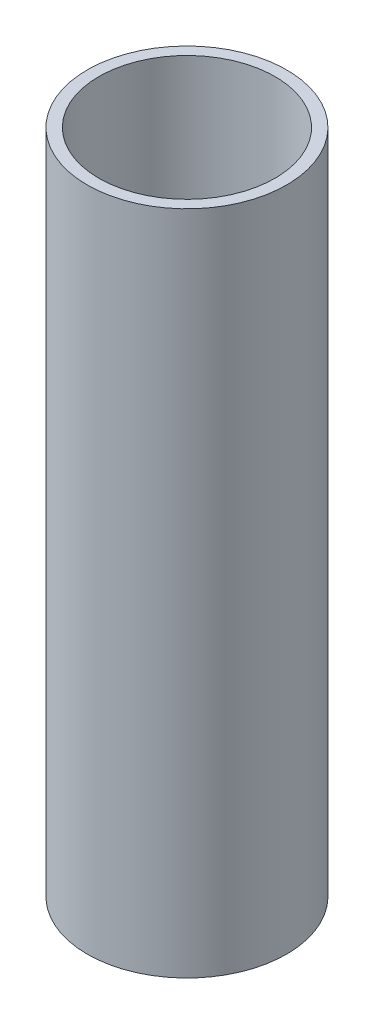
from build123d import *

# Parameters (mm, degrees)
SKETCH1_R                  = 3.00355
BOSS_EXTRUDE1_DEPTH        = 10.033
F_4_0_209_DIAMETER_HOLE1_D = 5.3086


with BuildPart() as part:
    # Sketch1 → Boss-Extrude1 (new, symmetric)
    with BuildSketch(Plane(origin=(0, 0, 0), x_dir=(1, 0, 0), z_dir=(0, 1, 0))):
        with Locations(Location((0, 0, 0), (0, 0, 270))):
            Circle(SKETCH1_R)
    extrude(amount=BOSS_EXTRUDE1_DEPTH, both=True)

    # #4 (0.209) Diameter Hole1 (through all)
    with Locations(Plane(origin=(0, 10.033, 0), x_dir=(1, 0, 0), z_dir=(0, 1, 0))):
        with Locations((0, 0)):
            Hole(F_4_0_209_DIAMETER_HOLE1_D / 2)


solid = part.part
